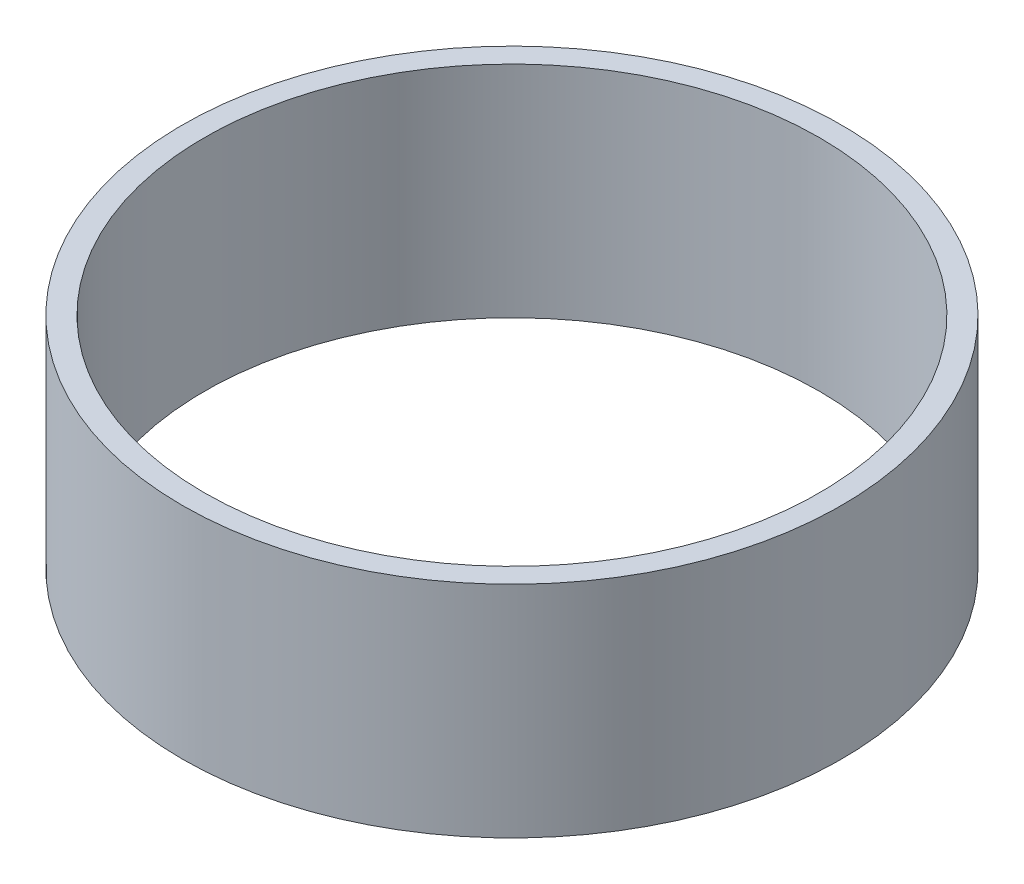
from build123d import *

# Parameters (mm, degrees)
SKETCH1_R           = 37.5
SKETCH1_R_2         = 35
BOSS_EXTRUDE1_DEPTH = 25


with BuildPart() as part:
    # Sketch1 → Boss-Extrude1 (new body)
    with BuildSketch(Plane(origin=(0, 0, 0), x_dir=(1, 0, 0), z_dir=(0, 1, 0))):
        with Locations(Location((0, 0, 0), (0, 0, 270))):
            Circle(SKETCH1_R)
        with Locations(Location((0, 0, 0), (0, 0, 270))):
            Circle(SKETCH1_R_2, mode=Mode.SUBTRACT)
    extrude(amount=BOSS_EXTRUDE1_DEPTH)


solid = part.part
